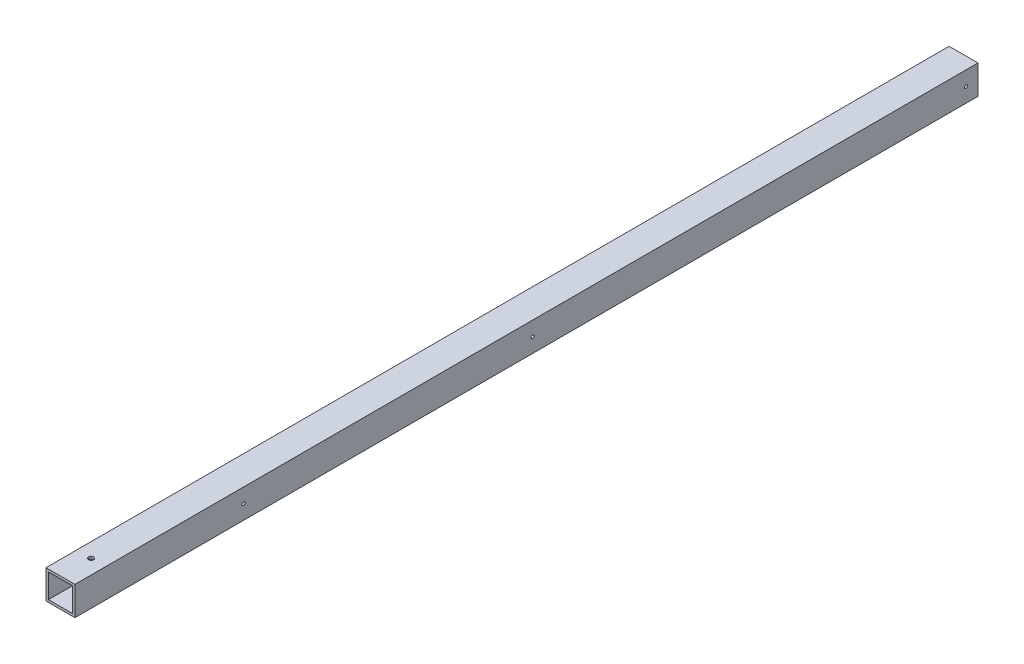
from build123d import *

# Parameters (mm, degrees)
SKETCH_1_W             = 24
SKETCH_1_H             = 24
SKETCH_1_W_2           = 20
SKETCH_1_H_2           = 20
EXTRUDE_1_DEPTH        = 375
HOLE_WIZARD_M3_1_D     = 2.5
HOLE_WIZARD_M5_1_D     = 4.2
HOLE_WIZARD_M5_1_DEPTH = 10
HOLE_WIZARD_M5_1_TIP   = 1.2618073


with BuildPart() as part:
    # 草图1 → 凸台-拉伸1 (new, symmetric)
    with BuildSketch(Plane.XY):
        Rectangle(SKETCH_1_W, SKETCH_1_H)
        Rectangle(SKETCH_1_W_2, SKETCH_1_H_2, mode=Mode.SUBTRACT)
    extrude(amount=EXTRUDE_1_DEPTH, both=True)

    # M3 螺纹孔的螺纹孔钻头1 (through all)
    with Locations(Plane(origin=(-12, 0, -365), x_dir=(0, -1, 0), z_dir=(-1, 0, 0))):
        with Locations((0, 0), (0, 360), (0, 600)):
            Hole(HOLE_WIZARD_M3_1_D / 2)

    # M5 螺纹孔的螺纹孔钻头1
    with Locations(Plane(origin=(0, 12, 349.5), x_dir=(0, 0, 1), z_dir=(0, 1, 0))):
        with Locations((0, 0)):
            Hole(HOLE_WIZARD_M5_1_D / 2, depth=HOLE_WIZARD_M5_1_DEPTH)
            with Locations((0, 0, -(HOLE_WIZARD_M5_1_DEPTH + HOLE_WIZARD_M5_1_TIP / 2))):  # 118° drill point
                Cone(0, HOLE_WIZARD_M5_1_D / 2, HOLE_WIZARD_M5_1_TIP, mode=Mode.SUBTRACT)


solid = part.part
